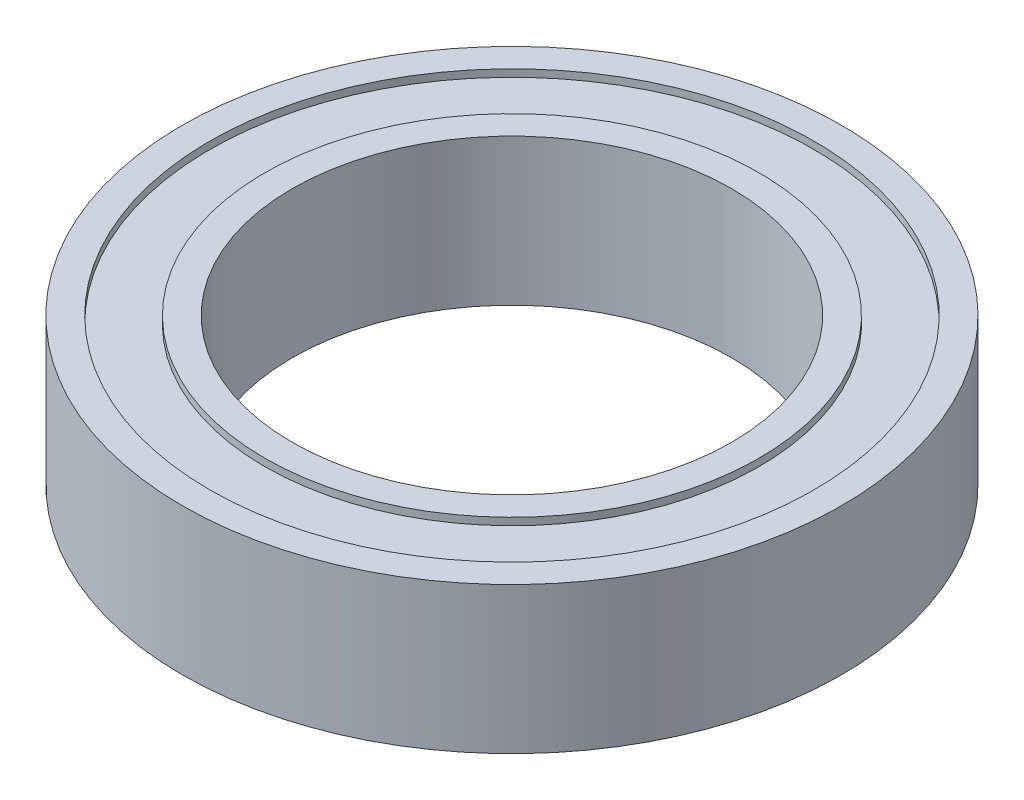
from build123d import *

# Parameters (mm, degrees)
EXTRUDE_1_DEPTH      = 2
EXTRUDE_1_DEPTH_BACK = 2
SKETCH_1_R           = 9
SKETCH_1_R_2         = 6
SKETCH_2_R           = 8.25
SKETCH_2_R_2         = 6.75
CUT_EXTRUDE_1_DEPTH  = 0.2


with BuildPart() as part:
    # 草图1 → 凸台-拉伸1 (new, two sides: drawn at the far end of the back side and taken through both)
    with BuildSketch(Plane(origin=(0, 0, 0), x_dir=(1, 0, 0), z_dir=(0, 1, 0)).offset(-EXTRUDE_1_DEPTH_BACK)):
        Circle(SKETCH_1_R)
        Circle(SKETCH_1_R_2, mode=Mode.SUBTRACT)
    extrude(amount=EXTRUDE_1_DEPTH + EXTRUDE_1_DEPTH_BACK)

    # 草图2 → 切除-拉伸1 (cut)
    with BuildSketch(Plane(origin=(0, 2, 0), x_dir=(1, 0, 0), z_dir=(0, 1, 0))):
        Circle(SKETCH_2_R)
        Circle(SKETCH_2_R_2, mode=Mode.SUBTRACT)
    cut_extrude_1 = extrude(amount=-CUT_EXTRUDE_1_DEPTH, mode=Mode.SUBTRACT)

    # 镜向1: 切除-拉伸1 across plane
    add(cut_extrude_1.mirror(Plane.ZX), mode=Mode.SUBTRACT)


solid = part.part
